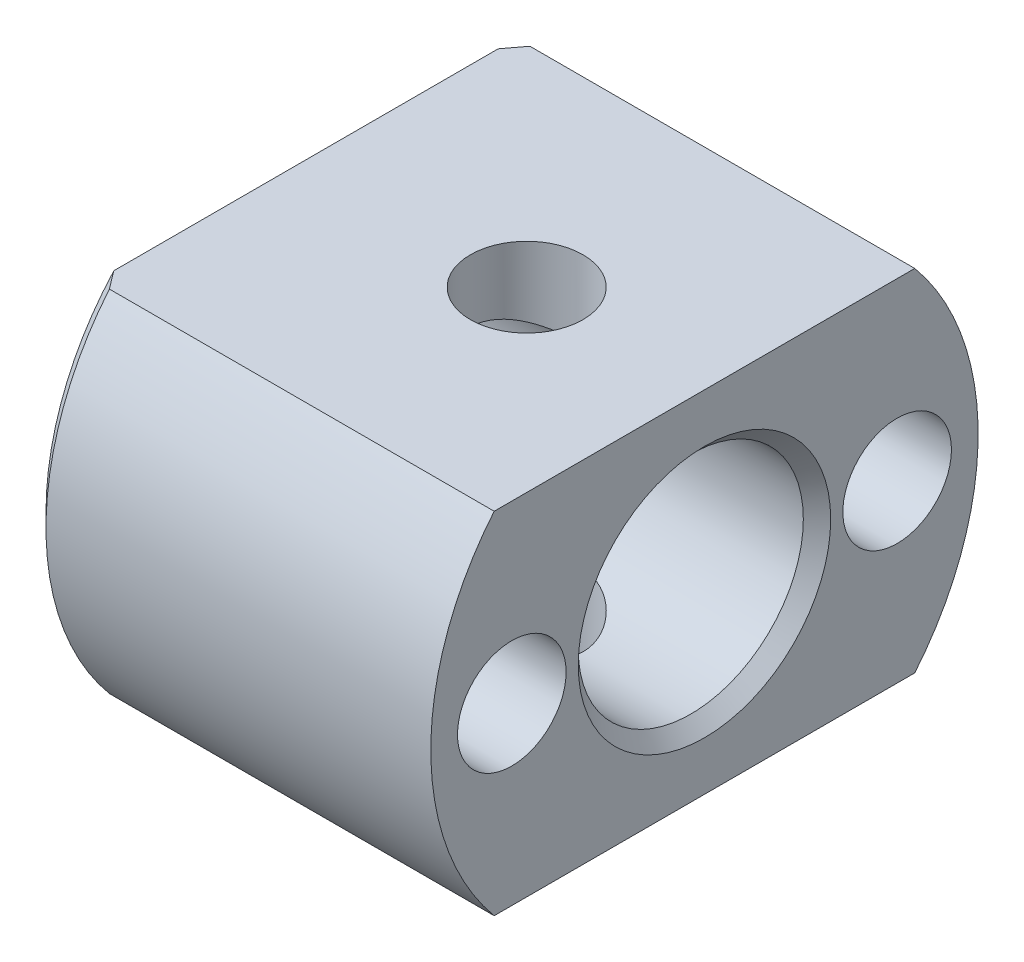
from build123d import *

# Parameters (mm, degrees)
SKETCH1_R                                 = 7.9375
SKETCH1_R_2                               = 1.575
SKETCH1_R_3                               = 3.2639
INNER_SIDE_EXTRUDE_DEPTH                  = 2.032
OUTER_START                               = -9.525
SKETCH1_3_R                               = 7.9375
SKETCH1_3_R_2                             = 1.575
SKETCH1_3_R_3                             = 3.2639
OUTER_SIDE_EXTRUDE_DEPTH                  = 9.525
CLEVIS_PIN_CUT_DEPTH                      = 15.721869362
CLEVIS_PIN_CUT_DEPTH_BACK                 = 15.721869362
SKETCH2_R                                 = 1.63195
CHAMFER_SO_STEVE_DOESN_T_CUT_HIMSELF_SIZE = 0.396875
CUT_EXTRUDE1_DEPTH                        = 15.721869469
CUT_EXTRUDE1_DEPTH_BACK                   = 15.721869469
SKETCH4_W                                 = 19.05
SKETCH4_H                                 = 4.803702905


with BuildPart() as part:
    # Sketch1 → Inner Side Extrude (new body)
    with BuildSketch(Plane(origin=(0, 0, 0), x_dir=(0, 0, -1), z_dir=(1, 0, 0))):
        Circle(SKETCH1_R)
        with Locations((5.588, 0)):
            Circle(SKETCH1_R_2, mode=Mode.SUBTRACT)
        with Locations((-5.588, 0)):
            Circle(SKETCH1_R_2, mode=Mode.SUBTRACT)
        Circle(SKETCH1_R_3, mode=Mode.SUBTRACT)
    extrude(amount=INNER_SIDE_EXTRUDE_DEPTH)

    # Sketch1<3> → Outer Side Extrude (add)
    with BuildSketch(Plane(origin=(0, 0, 0), x_dir=(0, 0, -1), z_dir=(1, 0, 0)).offset(OUTER_START)):
        Circle(SKETCH1_3_R)
        with Locations((5.588, 0)):
            Circle(SKETCH1_3_R_2, mode=Mode.SUBTRACT)
        with Locations((-5.588, 0)):
            Circle(SKETCH1_3_R_2, mode=Mode.SUBTRACT)
        Circle(SKETCH1_3_R_3, mode=Mode.SUBTRACT)
    extrude(amount=OUTER_SIDE_EXTRUDE_DEPTH)

    # Sketch2 → Clevis Pin Cut (cut, two sides: drawn at the far end of the back side and taken through both)
    with BuildSketch(Plane(origin=(0, 0, 0), x_dir=(1, 0, 0), z_dir=(0, 1, 0)).offset(-CLEVIS_PIN_CUT_DEPTH_BACK)):
        with Locations((-3.1242, 0)):
            Circle(SKETCH2_R)
    extrude(amount=CLEVIS_PIN_CUT_DEPTH + CLEVIS_PIN_CUT_DEPTH_BACK, mode=Mode.SUBTRACT)

    # Chamfer so Steve Doesn't cut himself
    chamfer_so_steve_doesn_t_cut_himself_edges = [part.edges().sort_by_distance(p)[0] for p in [
        (-9.525, 0, 3.2639),
        (2.032, 0, 3.2639),
        (-9.525, 0, 7.9375),
    ]]
    chamfer(chamfer_so_steve_doesn_t_cut_himself_edges, length=CHAMFER_SO_STEVE_DOESN_T_CUT_HIMSELF_SIZE)

    # Sketch4 → Cut-Extrude1 (cut, two sides: drawn at the far end of the back side and taken through both)
    with BuildSketch(Plane.XY.offset(-CUT_EXTRUDE1_DEPTH_BACK)):
        with Locations((-3.1242, 7.481851452)):
            Rectangle(SKETCH4_W, SKETCH4_H)
        with Locations((-3.1242, -7.481851452)):
            Rectangle(SKETCH4_W, SKETCH4_H)
    extrude(amount=CUT_EXTRUDE1_DEPTH + CUT_EXTRUDE1_DEPTH_BACK, mode=Mode.SUBTRACT)


solid = part.part
